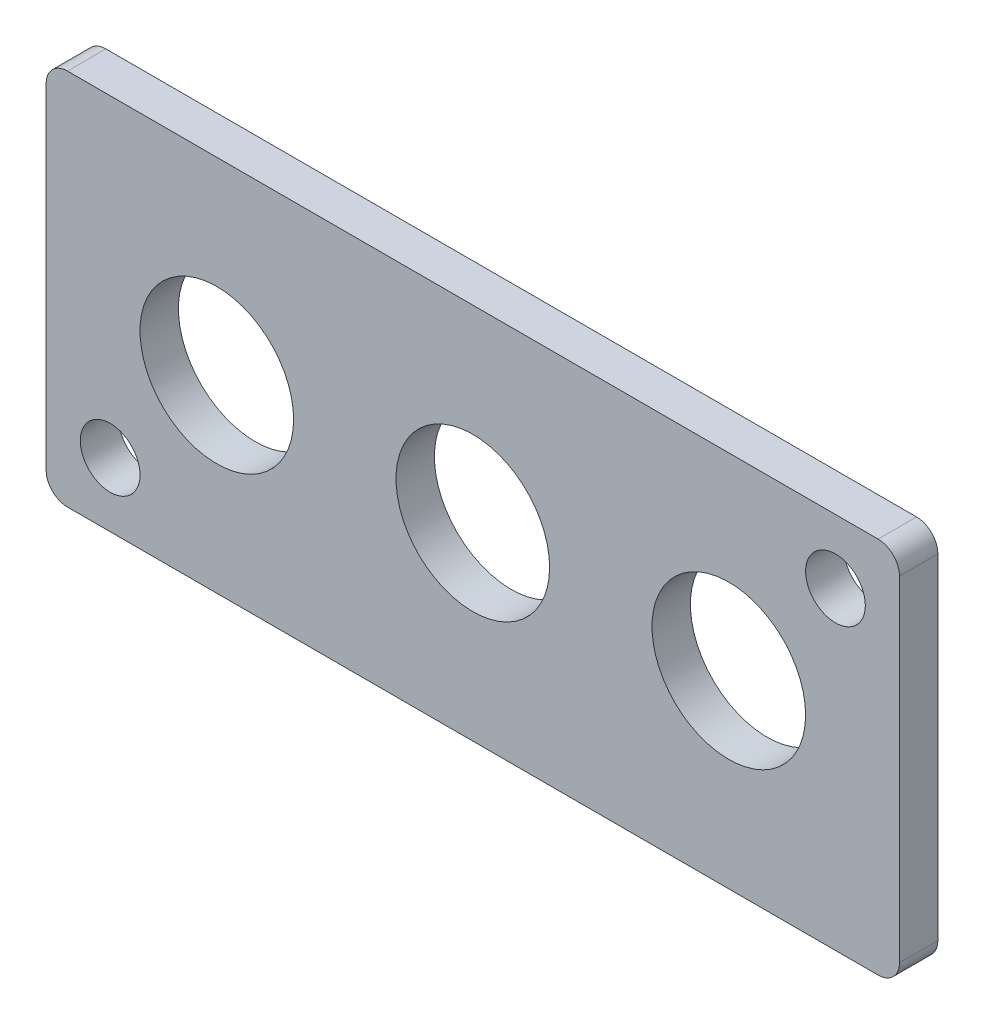
from build123d import *

# Parameters (mm, degrees)
RETAINING_PLATE_START               = 33.8
RETAINING_PLATE_DEPTH               = 1.8
PLUNGERS_AND_M2P5_SCREWS_DEPTH      = 117.372677206
PLUNGERS_AND_M2P5_SCREWS_DEPTH_BACK = 117.372677206
SKETCH_2_R                          = 3.6
SKETCH_2_R_2                        = 1.4


with BuildPart() as part:
    # 草图1 → Retaining_plate (new body)
    with BuildSketch(Plane.XY.offset(RETAINING_PLATE_START)):
        with BuildLine():
            Line((52, 45.5), (90, 45.5))
            ThreePointArc((90, 45.5), (90.707106781, 45.792893219), (91, 46.5))
            Line((91, 46.5), (91, 62.2))
            ThreePointArc((91, 62.2), (90.707106781, 62.907106781), (90, 63.2))
            Line((90, 63.2), (52, 63.2))
            ThreePointArc((52, 63.2), (51.292893219, 62.907106781), (51, 62.2))
            Line((51, 62.2), (51, 46.5))
            ThreePointArc((51, 46.5), (51.292893219, 45.792893219), (52, 45.5))
        make_face()
    extrude(amount=RETAINING_PLATE_DEPTH)

    # 草图2 → Plungers_and_M2p5_screws (cut, two sides: drawn at the far end of the back side and taken through both)
    with BuildSketch(Plane.XY.offset(-PLUNGERS_AND_M2P5_SCREWS_DEPTH_BACK)):
        with Locations((59, 54.355)):
            Circle(SKETCH_2_R)
        with Locations((71, 54.355)):
            Circle(SKETCH_2_R)
        with Locations((83, 54.355)):
            Circle(SKETCH_2_R)
        with Locations((54, 48.5)):
            Circle(SKETCH_2_R_2)
        with Locations((88, 60.2)):
            Circle(SKETCH_2_R_2)
    extrude(amount=PLUNGERS_AND_M2P5_SCREWS_DEPTH + PLUNGERS_AND_M2P5_SCREWS_DEPTH_BACK, mode=Mode.SUBTRACT)


solid = part.part
